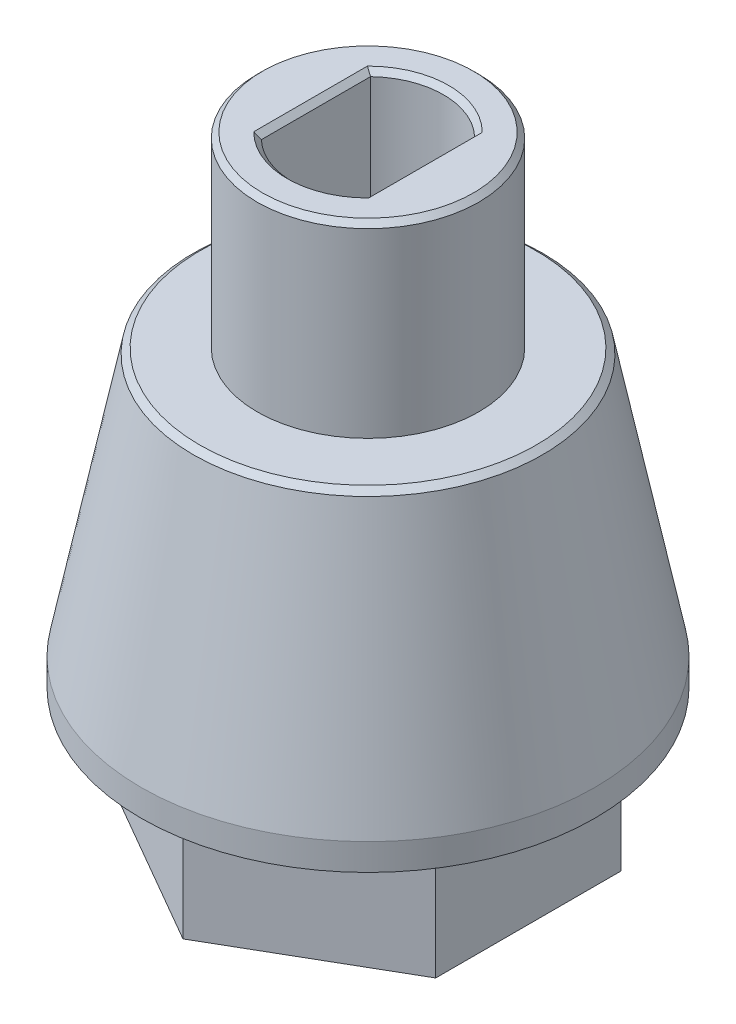
from build123d import *

# Parameters (mm, degrees)
BOSS_EXTRUDE1_DEPTH = 4.7
SKETCH2_R           = 8.5
BOSS_EXTRUDE2_DEPTH = 1
SKETCH4_R           = 6.5
SKETCH3_R           = 8.5
SKETCH5_R           = 4.15
BOSS_EXTRUDE3_DEPTH = 7
CHAMFER1_SIZE       = 0.2
SKETCH6_R           = 0.75
CUT_EXTRUDE1_DEPTH  = 7
CUT_EXTRUDE2_START  = -1
CUT_EXTRUDE2_DEPTH  = 1


with BuildPart() as part:
    # Sketch1 → Boss-Extrude1 (new body)
    with BuildSketch(Plane(origin=(0, 0, 0), x_dir=(1, 0, 0), z_dir=(0, 1, 0))):
        Polygon((0, 6.92820323), (6, 3.464101615), (6, -3.464101615), (0, -6.92820323), (-6, -3.464101615), (-6, 3.464101615), align=None)
    extrude(amount=BOSS_EXTRUDE1_DEPTH)

    # Sketch2 → Boss-Extrude2 (add)
    with BuildSketch(Plane(origin=(0, 4.7, 0), x_dir=(1, 0, 0), z_dir=(0, 1, 0))):
        with Locations(Location((0, 0, 0), (0, 0, 270))):
            Circle(SKETCH2_R)
    extrude(amount=BOSS_EXTRUDE2_DEPTH)

    # Sketch4 → Loft1 section 0
    with BuildSketch(Plane(origin=(0, 15.7, 0), x_dir=(1, 0, 0), z_dir=(0, 1, 0))):
        Circle(SKETCH4_R)
    # Sketch3 → Loft1 section 1
    with BuildSketch(Plane(origin=(0, 5.7, 0), x_dir=(1, 0, 0), z_dir=(0, 1, 0))):
        Circle(SKETCH3_R)
    loft()

    # Sketch5 → Boss-Extrude3 (add)
    with BuildSketch(Plane(origin=(0, 15.7, 0), x_dir=(1, 0, 0), z_dir=(0, 1, 0))):
        with Locations(Location((0, 0, 0), (0, 0, 270))):
            Circle(SKETCH5_R)
        with BuildLine():
            Line((-1.95, 2.044046232), (-1.95, -2.044046232))
            ThreePointArc((-1.95, -2.044046232), (0, -2.825), (1.95, -2.044046232))
            Line((1.95, -2.044046232), (1.95, 2.044046232))
            ThreePointArc((1.95, 2.044046232), (0, 2.825), (-1.95, 2.044046232))
        make_face(mode=Mode.SUBTRACT)
    extrude(amount=BOSS_EXTRUDE3_DEPTH)

    # Chamfer1
    chamfer1_edges = [part.edges().sort_by_distance(p)[0] for p in [
        (-6.5, 15.7, 0),
        (0, 22.7, -4.15),
        (0, 22.7, -2.825),
        (-1.95, 22.7, 0),
        (0, 22.7, 2.825),
        (1.95, 22.7, 0),
    ]]
    chamfer(chamfer1_edges, length=CHAMFER1_SIZE)

    # Sketch6 → Cut-Extrude1 (cut)
    with BuildSketch(Plane.XZ):
        with Locations(Location((0, 0, 0), (0, 0, 270))):
            Circle(SKETCH6_R)
    extrude(amount=-CUT_EXTRUDE1_DEPTH, mode=Mode.SUBTRACT)

    # Sketch7 → Cut-Extrude2 (cut)
    with BuildSketch(Plane(origin=(0, 15.7, 0), x_dir=(1, 0, 0), z_dir=(0, 1, 0)).offset(CUT_EXTRUDE2_START)):
        with BuildLine():
            Line((1.95, -2.044046232), (1.95, 2.044046232))
            ThreePointArc((1.95, 2.044046232), (0, 2.825), (-1.95, 2.044046232))
            Line((-1.95, 2.044046232), (-1.95, -2.044046232))
            ThreePointArc((-1.95, -2.044046232), (0, -2.825), (1.95, -2.044046232))
        make_face()
    extrude(amount=CUT_EXTRUDE2_DEPTH, mode=Mode.SUBTRACT)


solid = part.part
